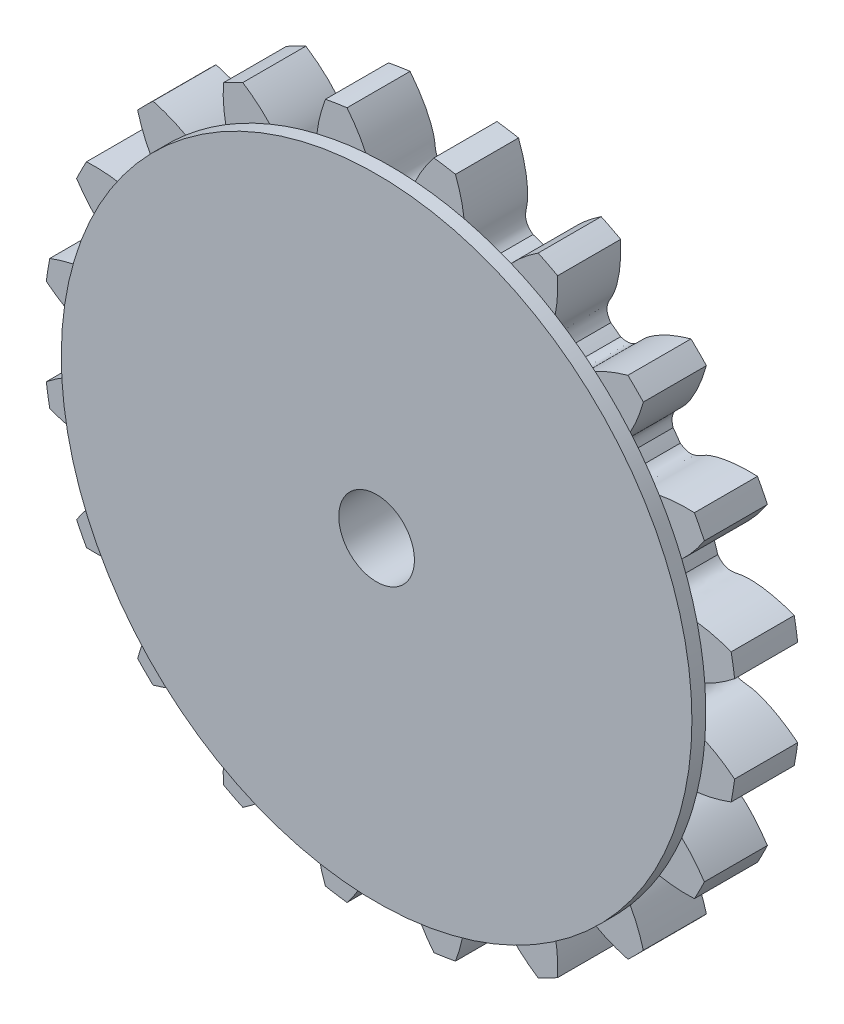
from build123d import *

# Parameters (mm, degrees)
SKETCH_1_R               = 5.5
EXTRUDE_1_DEPTH          = 1
CUT_EXTRUDE_1_DEPTH      = 8.842193571
PATTERN_CIRCULAR_1_COUNT = 20
SKETCH_4_R               = 5
EXTRUDE_2_DEPTH          = 0.22
SKETCH_5_R               = 0.6
CUT_EXTRUDE_2_DEPTH      = 8.812770237


with BuildPart() as part:
    # 草图1 → 凸台-拉伸1 (new body)
    with BuildSketch(Plane.XY):
        Circle(SKETCH_1_R)
    extrude(amount=EXTRUDE_1_DEPTH)

    # 草图2 → 切除-拉伸1 (cut, through all)
    with BuildSketch(Plane.XY):
        with BuildLine():
            ThreePointArc((0.0966583, 4.373932118), (0, 4.375), (-0.0966583, 4.373932118))
            add(Edge.make_bspline(
                [(-0.0966583, 4.373932118), (-0.305594702, 4.446737756), (-0.27854205, 4.593556849), (-0.306448528, 4.735004701), (-0.309446093, 4.748778307), (-0.313155445, 4.764317308), (-0.317646048, 4.781598418), (-0.32298957, 4.800595748), (-0.329256028, 4.821281414), (-0.336514936, 4.843625367), (-0.344834875, 4.867595474), (-0.35428355, 4.893157523), (-0.364927699, 4.92027525), (-0.376833051, 4.948910365), (-0.390064266, 4.979022576), (-0.404684882, 5.010569616), (-0.420757267, 5.043507275), (-0.438342558, 5.077789431), (-0.457500619, 5.113368075), (-0.478289983, 5.150193352), (-0.500767805, 5.18821359), (-0.524989813, 5.227375339), (-0.551010261, 5.267623403), (-0.578881878, 5.308900882), (-0.608655826, 5.35114921), (-0.64038165, 5.394308195), (-0.67410724, 5.43831606), (-0.709878781, 5.483109486), (-0.747740713, 5.528623656), (-0.787735693, 5.574792297), (-0.829904548, 5.621547731), (-0.874286244, 5.668820917), (-0.920917842, 5.716541501), (-0.969834463, 5.764637863), (-1.021069253, 5.81303717), (-1.074653349, 5.861665421), (-1.130615845, 5.910447505), (-1.188983759, 5.95930725), (-1.249782006, 6.008167473), (-1.313033367, 6.056950041), (-1.37875845, 6.10557592), (-1.470736795, 6.170819934), (-1.541966206, 6.218166301), (-1.590578991, 6.24912593)],
                knots=[0, 0, 0, 0, 0.165916003, 0.170905922, 0.176663519, 0.183188797, 0.190481754, 0.198542391, 0.207370708, 0.216966704, 0.22733038, 0.238461736, 0.250360771, 0.263027487, 0.276461881, 0.290663956, 0.30563371, 0.321371144, 0.337876258, 0.355149051, 0.373189524, 0.391997677, 0.411573509, 0.431917021, 0.453028213, 0.474907084, 0.497553636, 0.520967867, 0.545149777, 0.570099367, 0.595816637, 0.622301587, 0.649554216, 0.677574526, 0.706362514, 0.735918183, 0.766241531, 0.797332559, 0.829191267, 0.861817654, 0.895211721, 0.929373468, 1, 1, 1, 1], degree=3))
            ThreePointArc((-1.590578991, 6.24912593), (0, 6.44837316), (1.590578991, 6.24912593))
            add(Edge.make_bspline(
                [(0.0966583, 4.373932118), (0.305594702, 4.446737756), (0.27854205, 4.593556849), (0.306448528, 4.735004701), (0.309446093, 4.748778307), (0.313155445, 4.764317308), (0.317646048, 4.781598418), (0.32298957, 4.800595748), (0.329256028, 4.821281414), (0.336514936, 4.843625367), (0.344834875, 4.867595474), (0.35428355, 4.893157523), (0.364927699, 4.92027525), (0.376833051, 4.948910365), (0.390064266, 4.979022576), (0.404684882, 5.010569616), (0.420757267, 5.043507275), (0.438342558, 5.077789431), (0.457500619, 5.113368075), (0.478289983, 5.150193352), (0.500767805, 5.18821359), (0.524989813, 5.227375339), (0.551010261, 5.267623403), (0.578881878, 5.308900882), (0.608655826, 5.35114921), (0.64038165, 5.394308195), (0.67410724, 5.43831606), (0.709878781, 5.483109486), (0.747740713, 5.528623656), (0.787735693, 5.574792297), (0.829904548, 5.621547731), (0.874286244, 5.668820917), (0.920917842, 5.716541501), (0.969834463, 5.764637863), (1.021069253, 5.81303717), (1.074653349, 5.861665421), (1.130615845, 5.910447505), (1.188983759, 5.95930725), (1.249782006, 6.008167473), (1.313033367, 6.056950041), (1.37875845, 6.10557592), (1.470736795, 6.170819934), (1.541966206, 6.218166301), (1.590578991, 6.24912593)],
                knots=[0, 0, 0, 0, 0.165916003, 0.170905922, 0.176663519, 0.183188797, 0.190481754, 0.198542391, 0.207370708, 0.216966704, 0.22733038, 0.238461736, 0.250360771, 0.263027487, 0.276461881, 0.290663956, 0.30563371, 0.321371144, 0.337876258, 0.355149051, 0.373189524, 0.391997677, 0.411573509, 0.431917021, 0.453028213, 0.474907084, 0.497553636, 0.520967867, 0.545149777, 0.570099367, 0.595816637, 0.622301587, 0.649554216, 0.677574526, 0.706362514, 0.735918183, 0.766241531, 0.797332559, 0.829191267, 0.861817654, 0.895211721, 0.929373468, 1, 1, 1, 1], degree=3))
        make_face()
    cut_extrude_1 = extrude(amount=CUT_EXTRUDE_1_DEPTH, mode=Mode.SUBTRACT)

    # 阵列(圆周)1: 切除-拉伸1 ×20 about axis
    pattern_circular_1_axis = Axis((0, 0, -1.5), (0, 0, 1))
    for i in range(1, PATTERN_CIRCULAR_1_COUNT):
        add(cut_extrude_1.rotate(pattern_circular_1_axis, i * 360 / PATTERN_CIRCULAR_1_COUNT), mode=Mode.SUBTRACT)

    # 草图4 → 凸台-拉伸2 (add)
    with BuildSketch(Plane.XY.offset(1)):
        Circle(SKETCH_4_R)
    extrude(amount=EXTRUDE_2_DEPTH)

    # 草图5 → 切除-拉伸2 (cut, through all)
    with BuildSketch(Plane.XY.offset(1.22)):
        Circle(SKETCH_5_R)
    extrude(amount=-CUT_EXTRUDE_2_DEPTH, mode=Mode.SUBTRACT)


solid = part.part
